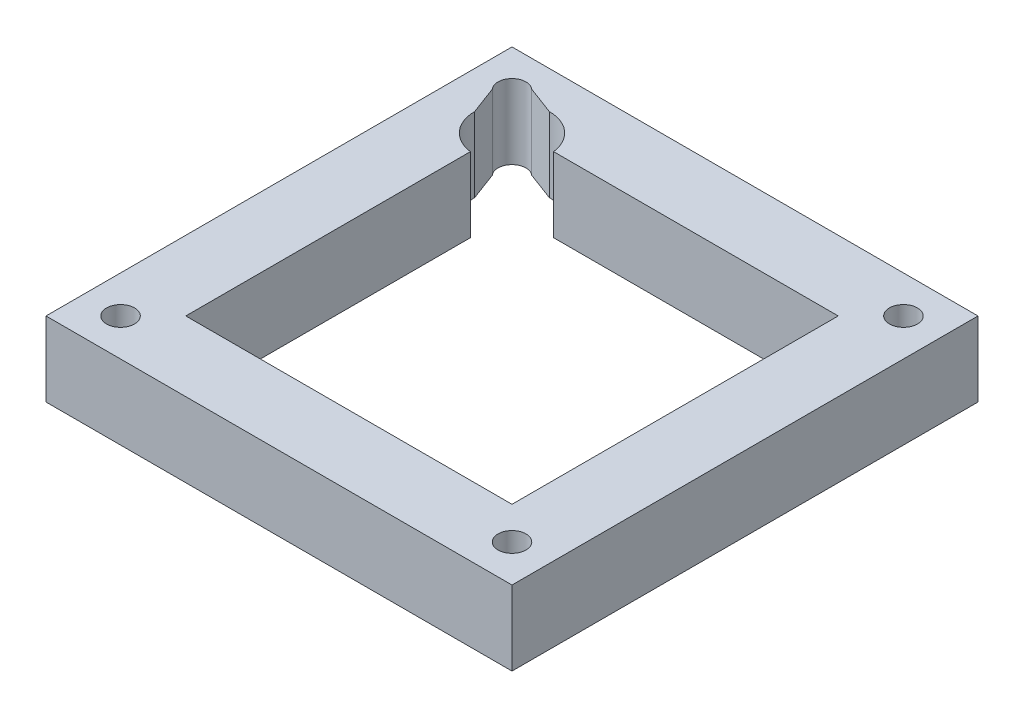
from build123d import *

# Parameters (mm, degrees)
SKETCH1_W       = 50
SKETCH1_H       = 50
SKETCH1_R       = 1.5
SUPPORT_DEPTH   = 8
NORTH_START     = -25
SKETCH2_W       = 20
SKETCH2_H       = 5
NORTH_CUT_DEPTH = 4
WEST_START      = -25
SKETCH3_W       = 20
SKETCH3_H       = 5
WEST_CUT_DEPTH  = 4


with BuildPart() as part:
    # Sketch1 → Support (new body)
    with BuildSketch(Plane(origin=(0, 0, 0), x_dir=(1, 0, 0), z_dir=(0, 1, 0))):
        Rectangle(SKETCH1_W, SKETCH1_H)
        with Locations(Location((-21, -21, 0), (0, 0, 270))):
            Circle(SKETCH1_R, mode=Mode.SUBTRACT)
        with Locations(Location((21, -21, 0), (0, 0, 270))):
            Circle(SKETCH1_R, mode=Mode.SUBTRACT)
        with BuildLine():
            Line((-13.031373033, 17.5), (17.5, 17.5))
            Line((17.5, 17.5), (17.5, -17.5))
            Line((17.5, -17.5), (-17.5, -17.5))
            Line((-17.5, -17.5), (-17.5, 13.031373033))
            ThreePointArc((-17.5, 13.031373033), (-20, 14.354248689), (-21, 17))
            Line((-21, 17), (-22.130136986, 20.01369863))
            ThreePointArc((-22.130136986, 20.01369863), (-22.060660172, 22.060660172), (-20.01369863, 22.130136986))
            Line((-20.01369863, 22.130136986), (-17, 21))
            ThreePointArc((-17, 21), (-14.354248689, 20), (-13.031373033, 17.5))
        make_face(mode=Mode.SUBTRACT)
        with Locations(Location((21, 21, 0), (0, 0, 270))):
            Circle(SKETCH1_R, mode=Mode.SUBTRACT)
    extrude(amount=SUPPORT_DEPTH)

    # Sketch2 → North Cut (cut)
    with BuildSketch(Plane.XY.offset(NORTH_START)):
        with Locations((0, 4)):
            Rectangle(SKETCH2_W, SKETCH2_H)
    extrude(amount=NORTH_CUT_DEPTH, mode=Mode.SUBTRACT)

    # Sketch3 → West Cut (cut)
    with BuildSketch(Plane(origin=(0, 0, 0), x_dir=(0, 0, -1), z_dir=(1, 0, 0)).offset(WEST_START)):
        with Locations((0, 4)):
            Rectangle(SKETCH3_W, SKETCH3_H)
    extrude(amount=WEST_CUT_DEPTH, mode=Mode.SUBTRACT)


solid = part.part
